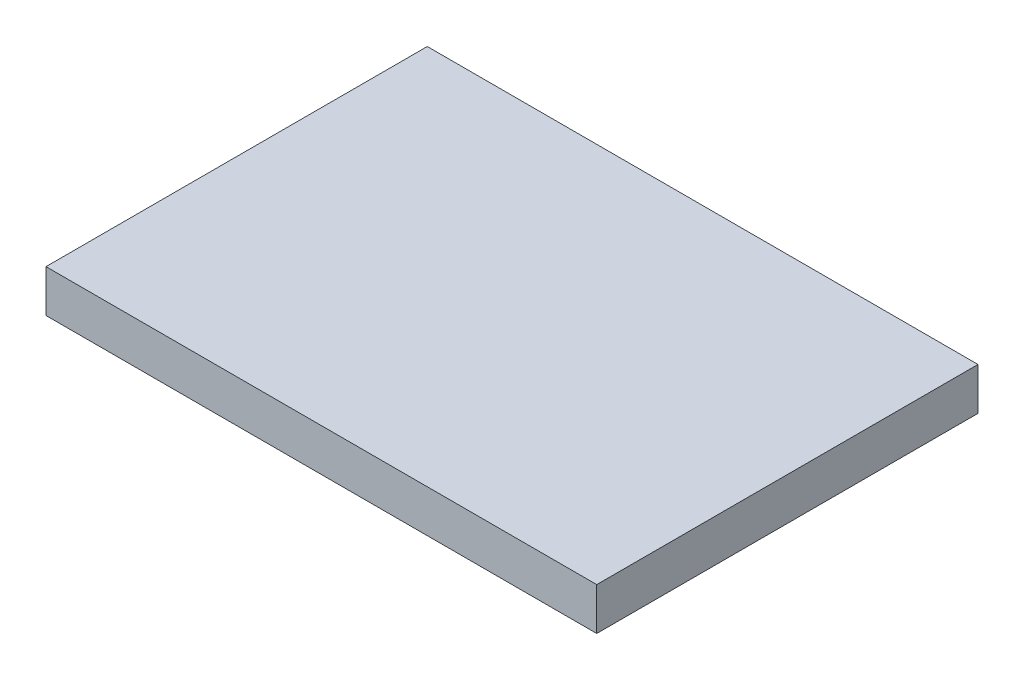
from build123d import *

# Parameters (mm, degrees)
SKETCH1_W     = 650
SKETCH1_H     = 450
BATTERY_DEPTH = 50


with BuildPart() as part:
    # Sketch1 → BATTERY (new body)
    with BuildSketch(Plane(origin=(0, 0, 0), x_dir=(1, 0, 0), z_dir=(0, 1, 0))):
        with Locations((325, 225)):
            Rectangle(SKETCH1_W, SKETCH1_H)
    extrude(amount=BATTERY_DEPTH)


solid = part.part
